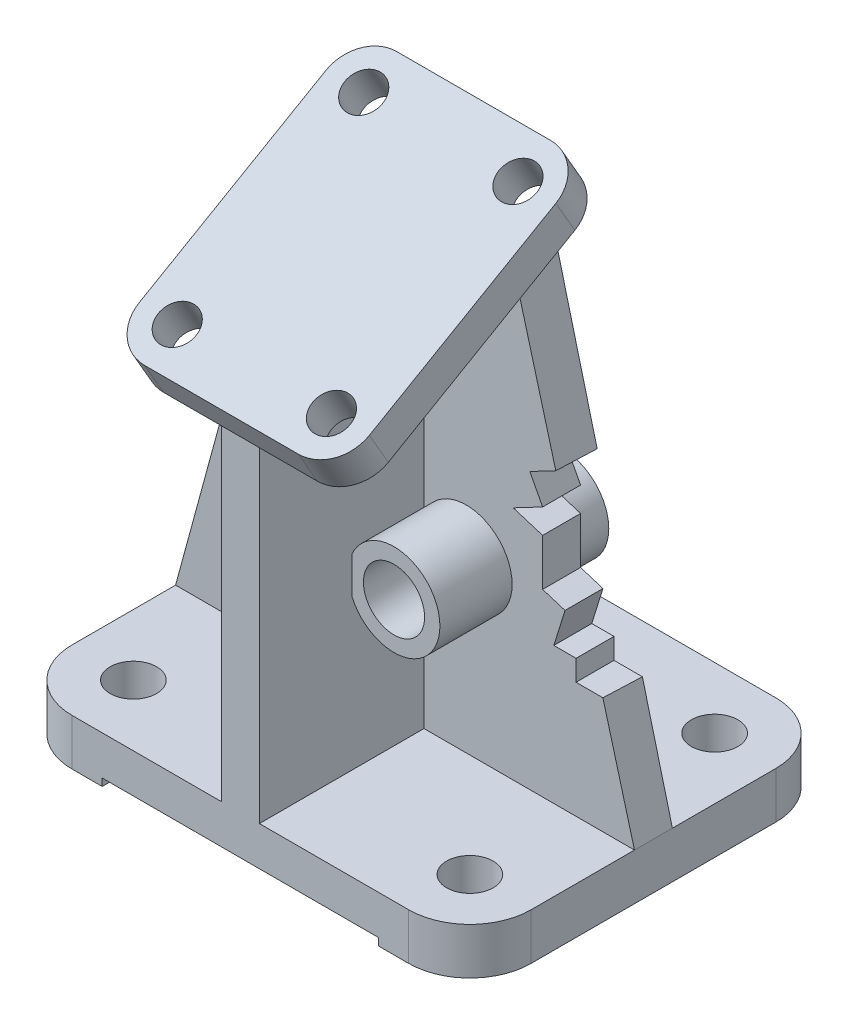
from build123d import *

# Parameters (mm, degrees)
CROQUIS1_R              = 4.826
SALIENTE_EXTRUIR1_DEPTH = 9.652
CROQUIS2_W              = 57.404
CROQUIS2_H              = 1.524
CORTAR_EXTRUIR1_DEPTH   = 91.375559356
CROQUIS4_R              = 3.937
SALIENTE_EXTRUIR2_DEPTH = 7.874
SALIENTE_EXTRUIR3_REACH = 207.578
SALIENTE_EXTRUIR4_START = 14.986
CROQUIS8_R              = 9.525
CROQUIS8_R_2            = 6.35
SALIENTE_EXTRUIR4_DEPTH = 35.052
CROQUIS8_2_R            = 6.35
CORTAR_EXTRUIR2_DEPTH   = 131.731959853
CORTAR_EXTRUIR3_DEPTH   = 131.731959853


with BuildPart() as part:
    # Croquis1 → Saliente-Extruir1 (new body)
    with BuildSketch(Plane(origin=(0, 0, 0), x_dir=(1, 0, 0), z_dir=(0, 1, 0))):
        with BuildLine():
            Line((-34.925, 38.1), (34.925, 38.1))
            ThreePointArc((34.925, 38.1), (43.905256121, 34.380256121), (47.625, 25.4))
            Line((47.625, 25.4), (47.625, -25.4))
            ThreePointArc((47.625, -25.4), (43.905256121, -34.380256121), (34.925, -38.1))
            Line((34.925, -38.1), (-34.925, -38.1))
            ThreePointArc((-34.925, -38.1), (-43.905256121, -34.380256121), (-47.625, -25.4))
            Line((-47.625, -25.4), (-47.625, 25.4))
            ThreePointArc((-47.625, 25.4), (-43.905256121, 34.380256121), (-34.925, 38.1))
        make_face()
        with Locations((-34.925, 25.4)):
            Circle(CROQUIS1_R, mode=Mode.SUBTRACT)
        with Locations((34.925, 25.4)):
            Circle(CROQUIS1_R, mode=Mode.SUBTRACT)
        with Locations((-34.925, -25.4)):
            Circle(CROQUIS1_R, mode=Mode.SUBTRACT)
        with Locations((34.925, -25.4)):
            Circle(CROQUIS1_R, mode=Mode.SUBTRACT)
    extrude(amount=SALIENTE_EXTRUIR1_DEPTH)

    # Croquis2 → Cortar-Extruir1 (cut, through all)
    with BuildSketch(Plane.XY.offset(38.1)):
        with Locations((0, 0.762)):
            Rectangle(CROQUIS2_W, CROQUIS2_H)
    extrude(amount=-CORTAR_EXTRUIR1_DEPTH, mode=Mode.SUBTRACT)



with BuildPart() as body_2:
    # Croquis4 → Saliente-Extruir2 (new body)
    with BuildSketch(Plane(origin=(0, 74.409783942, 42.960508789), x_dir=(0, 0.5000000000000009, -0.866025403784438), z_dir=(0, -0.8660254037844382, -0.500000000000001))):
        with BuildLine():
            Line((58.190432116, -23.876), (13.486432116, -23.876))
            ThreePointArc((13.486432116, -23.876), (7.918673321, -21.569758795), (5.612432116, -16.002))
            Line((5.612432116, -16.002), (5.612432116, 16.002))
            ThreePointArc((5.612432116, 16.002), (7.918673321, 21.569758795), (13.486432116, 23.876))
            Line((13.486432116, 23.876), (58.190432116, 23.876))
            ThreePointArc((58.190432116, 23.876), (63.758190911, 21.569758795), (66.064432116, 16.002))
            Line((66.064432116, 16.002), (66.064432116, -16.002))
            ThreePointArc((66.064432116, -16.002), (63.758190911, -21.569758795), (58.190432116, -23.876))
        make_face()
        with Locations((58.190432116, -16.002)):
            Circle(CROQUIS4_R, mode=Mode.SUBTRACT)
        with Locations((13.486432116, 16.002)):
            Circle(CROQUIS4_R, mode=Mode.SUBTRACT)
        with Locations((13.486432116, -16.002)):
            Circle(CROQUIS4_R, mode=Mode.SUBTRACT)
        with Locations((58.190432116, 16.002)):
            Circle(CROQUIS4_R, mode=Mode.SUBTRACT)
    extrude(amount=-SALIENTE_EXTRUIR2_DEPTH)


with BuildPart() as part_1:
    add(part.part)

    add(body_2.part)  # Saliente-Extruir3 merges body 2
    # Saliente-Extruir3: up to this plane
    saliente_extruir3_end = Plane(origin=(16.002, 103.505, -7.43388368), z_dir=(0, -0.866025403784438, -0.5000000000000009))
    # Croquis5 → Saliente-Extruir3 (add, up to the surface)
    with BuildSketch(Plane(origin=(0, 9.652, 0), x_dir=(1, 0, 0), z_dir=(0, 1, 0)), mode=Mode.PRIVATE) as saliente_extruir3_sk1:
        Polygon((-47.625, 3.937), (47.625, 3.937), (47.625, -3.937), (3.937, -3.937), (3.937, -38.1), (-3.937, -38.1), (-3.937, -3.937), (-47.625, -3.937), align=None)
    saliente_extruir3_tool1 = split(extrude(saliente_extruir3_sk1.sketch, amount=SALIENTE_EXTRUIR3_REACH, mode=Mode.PRIVATE), bisect_by=saliente_extruir3_end, keep=Keep.BOTH, mode=Mode.PRIVATE)
    add(saliente_extruir3_tool1.solids().sort_by_distance((0, 9.652, 5.548554))[0])

    # Croquis6 → Cortar-Recubrir2 section 0
    with BuildSketch(Plane.XY.offset(3.937)):
        with BuildLine():
            Line((23.876, 96.940017246), (47.625, 9.652))
            Line((47.625, 9.652), (47.625, 96.940017246))
            Line((47.625, 96.940017246), (23.876, 96.940017246))
        make_face()
    # Croquis7 → Cortar-Recubrir2 section 1
    with BuildSketch(Plane(origin=(0, 0, -3.937), x_dir=(-1, 0, 0), z_dir=(0, 0, -1))):
        with BuildLine():
            Line((-23.876, 101.486073266), (-47.625, 9.652))
            Line((-47.625, 9.652), (-47.625, 101.486073266))
            Line((-47.625, 101.486073266), (-23.876, 101.486073266))
        make_face()
    cortar_recubrir2 = loft(mode=Mode.SUBTRACT)

    # Simetría1: Cortar-Recubrir2 across plane
    add(cortar_recubrir2.mirror(Plane(origin=(0, 0, 0), x_dir=(0, 0, 1), z_dir=(1, 0, 0))), mode=Mode.SUBTRACT)

    # Croquis8 → Saliente-Extruir4 (add)
    with BuildSketch(Plane.XY.offset(3.937).offset(SALIENTE_EXTRUIR4_START)):
        with Locations((12.7, 44.704)):
            Circle(CROQUIS8_R)
        with Locations((12.7, 44.704)):
            Circle(CROQUIS8_R_2, mode=Mode.SUBTRACT)
    extrude(amount=-SALIENTE_EXTRUIR4_DEPTH)

    # Croquis8<2> → Cortar-Extruir2 (cut, through all)
    with BuildSketch(Plane.XY.offset(3.937)):
        with Locations((12.7, 44.704)):
            Circle(CROQUIS8_2_R)
    extrude(amount=-CORTAR_EXTRUIR2_DEPTH, mode=Mode.SUBTRACT)

    # Croquis9 → Cortar-Extruir3 (cut, through all)
    with BuildSketch(Plane.XY.offset(3.937)):
        Polygon((35.501063323, 71.882673058), (25.906181344, 66.845360019), (28.559347202, 61.791710765), (22.462060614, 58.590635306), (28.559347202, 56.691480467), (28.559347202, 46.97675609), (33.208528226, 45.528650525), (30.883937714, 38.065491513), (35.501063323, 38.065491513), (35.501063323, 33.754439669), (44.724683108, 33.754439669), align=None)
    extrude(amount=-CORTAR_EXTRUIR3_DEPTH, mode=Mode.SUBTRACT)


solid = part_1.part
